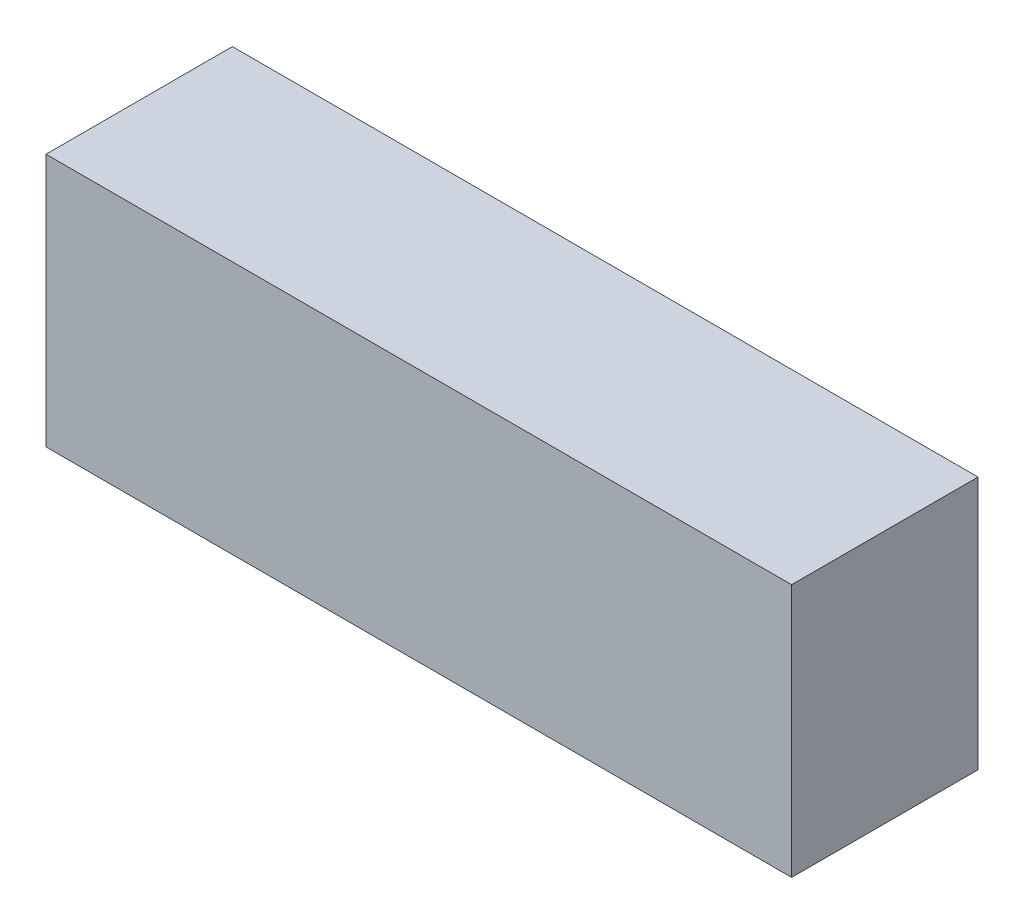
from build123d import *

# Parameters (mm, degrees)
SKIZZE1_W                       = 100
SKIZZE1_H                       = 34
AUFSATZ_LINEAR_AUSTRAGEN1_DEPTH = 25


with BuildPart() as part:
    # Skizze1 → Aufsatz-Linear austragen1 (new body)
    with BuildSketch(Plane.XY):
        with Locations((50, 17)):
            Rectangle(SKIZZE1_W, SKIZZE1_H)
    extrude(amount=AUFSATZ_LINEAR_AUSTRAGEN1_DEPTH)


solid = part.part
